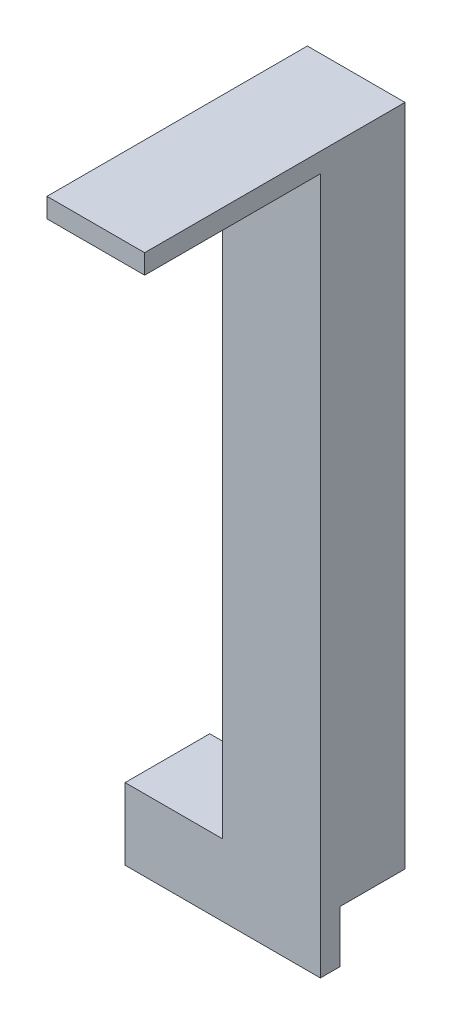
from build123d import *

# Parameters (mm, degrees)
SKETCH_1_W          = 30
SKETCH_1_H          = 3
EXTRUDE_2_DEPTH     = 11
SKETCH_1_5_W        = 30
SKETCH_1_5_H        = 10
EXTRUDE_3_DEPTH     = 3
EXTRUDE_4_DEPTH     = 30
CUT_EXTRUDE_1_DEPTH = 15


with BuildPart() as part:
    # 草图1 → 凸台-拉伸2 (new body)
    with BuildSketch(Plane(origin=(0, 0, 0), x_dir=(1, 0, 0), z_dir=(0, 1, 0))):
        with Locations((15, -11.5)):
            Rectangle(SKETCH_1_W, SKETCH_1_H)
    extrude(amount=-EXTRUDE_2_DEPTH)

    # 草图1<5> → 凸台-拉伸3 (add)
    with BuildSketch(Plane(origin=(0, 0, 0), x_dir=(1, 0, 0), z_dir=(0, 1, 0))):
        with Locations((15, -5)):
            Rectangle(SKETCH_1_5_W, SKETCH_1_5_H)
    extrude(amount=-EXTRUDE_3_DEPTH)

    # 草图3 → 凸台-拉伸4 (add)
    with BuildSketch(Plane.ZY):
        Polygon((0, 0), (0, 99), (40, 99), (40, 96), (13, 96), (13, 0), align=None)
    extrude(amount=-EXTRUDE_4_DEPTH)

    # 草图3<4> → 切除-拉伸1 (cut)
    with BuildSketch(Plane.ZY):
        Polygon((0, 0), (0, 99), (40, 99), (40, 96), (13, 96), (13, 0), align=None)
    extrude(amount=-CUT_EXTRUDE_1_DEPTH, mode=Mode.SUBTRACT)


solid = part.part
